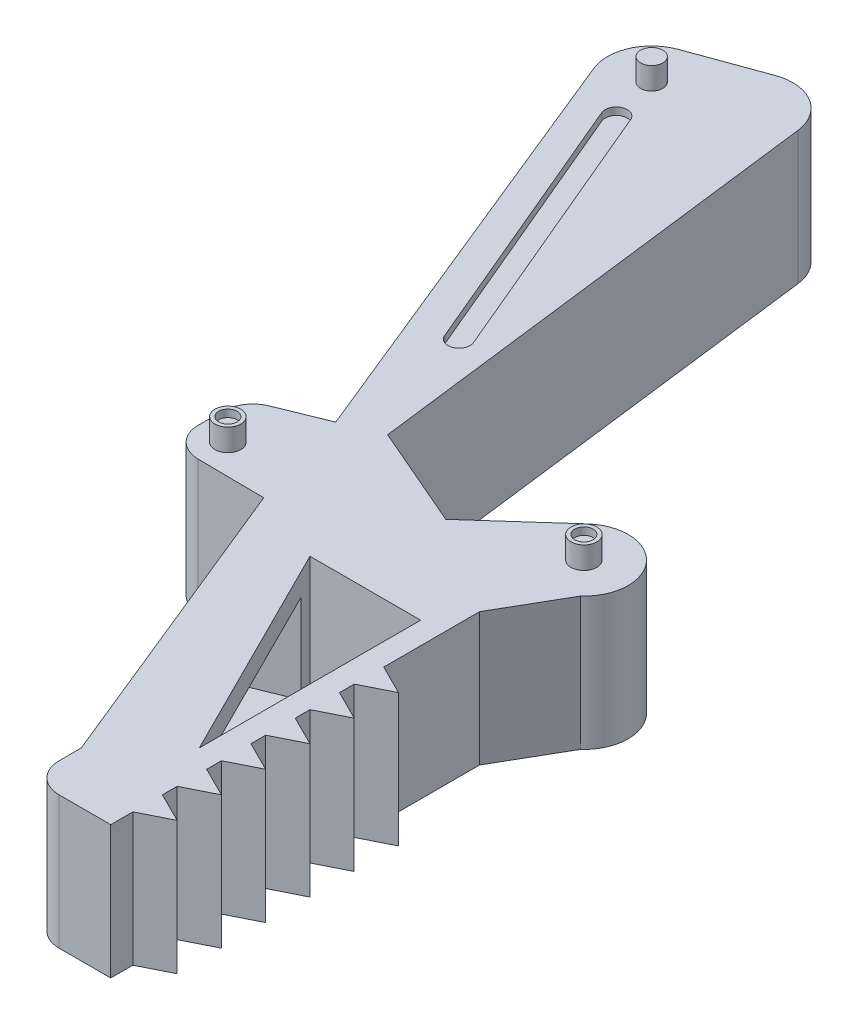
from build123d import *

# Parameters (mm, degrees)
BOSS_EXTRUDE1_DEPTH = 9
FILLET1_R           = 6
FILLET2_R           = 4
BOSS_EXTRUDE2_DEPTH = 18
LPATTERN1_COUNT     = 6
LPATTERN1_PITCH     = 6
CUT_EXTRUDE1_DEPTH  = 145.41368733
SKETCH6_W           = 30.064521177
SKETCH6_H           = 12
CUT_EXTRUDE2_DEPTH  = 10
SKETCH8_R           = 1.75
SKETCH8_R_2         = 1.5
BOSS_EXTRUDE3_DEPTH = 3
SKETCH9_R           = 1.25
CUT_EXTRUDE4_DEPTH  = 1
SKETCH10_R          = 1.25
CUT_EXTRUDE5_DEPTH  = 1
CUT_EXTRUDE6_DEPTH  = 1


with BuildPart() as part:
    # Sketch2 → Boss-Extrude1 (new, symmetric)
    with BuildSketch(Plane(origin=(0, 0, 0), x_dir=(1, 0, 0), z_dir=(0, 1, 0))):
        with BuildLine():
            ThreePointArc((7, -67.928205718), (15.472135955, -68.400341673), (15, -76.872477628))
            Line((15, -76.872477628), (10, -85.532731666))
            Line((10, -85.532731666), (10, -135.532731666))
            Line((10, -135.532731666), (-1, -135.532731666))
            Line((-1, -135.532731666), (-1, -128.532731666))
            Line((-1, -128.532731666), (-18, -86.797721556))
            Line((-18, -86.797721556), (-30.999248866, -86.657975615))
            Line((-30.999248866, -86.657975615), (-30.891751988, -76.658553411))
            Line((-30.891751988, -76.658553411), (-17, -71))
            Line((-17, -71), (-3.134175553, -76.992487891))
            Line((-3.134175553, -76.992487891), (7, -67.928205718))
        make_face()
        Polygon((-17, -71), (-22, -73.036659384), (-48.406582583, -8.20848344), (-25.853959684, 0), align=None)
    extrude(amount=BOSS_EXTRUDE1_DEPTH, both=True)

    # Fillet1
    fillet1_edges = [part.edges().sort_by_distance(p)[0] for p in [
        (-48.406582583, 0, 8.20848344),
        (-25.853959684, 0, 0),
    ]]
    fillet(fillet1_edges, radius=FILLET1_R)

    # Fillet2
    fillet2_edges = [part.edges().sort_by_distance(p)[0] for p in [
        (-1, 0, 135.532731666),
        (-30.999248866, 0, 86.657975615),
        (-30.891751988, 0, 76.658553411),
    ]]
    fillet(fillet2_edges, radius=FILLET2_R)

    # Sketch3 → Boss-Extrude2 (add)
    with BuildSketch(Plane(origin=(0, 9, 0), x_dir=(1, 0, 0), z_dir=(0, 1, 0))):
        Polygon((10, -132.532731666), (10, -128.532731666), (14, -130.532731666), align=None)
    boss_extrude2 = extrude(amount=-BOSS_EXTRUDE2_DEPTH)

    # LPattern1: Boss-Extrude2 ×6
    with Locations(*[(0, 0, -i * LPATTERN1_PITCH) for i in range(1, LPATTERN1_COUNT)]):
        add(boss_extrude2)

    # Sketch5 → Cut-Extrude1 (cut, through all)
    with BuildSketch(Plane(origin=(0, 9, 0), x_dir=(1, 0, 0), z_dir=(0, 1, 0))):
        Polygon((7, -120.532731666), (7, -90.532731666), (-8, -90.532731666), align=None)
    extrude(amount=-CUT_EXTRUDE1_DEPTH, mode=Mode.SUBTRACT)

    # Sketch6 → Cut-Extrude2 (cut)
    with BuildSketch(Plane(origin=(-45.762584731, 0, 18.64055953), x_dir=(0.377236894037746, 0, 0.9261167992088009), z_dir=(-0.9261167992088009, 0, 0.377236894037746))):
        with Locations((98.626824562, 0)):
            Rectangle(SKETCH6_W, SKETCH6_H)
    extrude(amount=-CUT_EXTRUDE2_DEPTH, mode=Mode.SUBTRACT)

    # Sketch8 → Boss-Extrude3 (add)
    with BuildSketch(Plane(origin=(0, 9, 0), x_dir=(1, 0, 0), z_dir=(0, 1, 0))):
        with Locations(Location((-26.956481233, -82.701205484, 0), (0, 0, 270))):
            Circle(SKETCH8_R)
        with Locations(Location((11, -72.400341673, 0), (0, 0, 270))):
            Circle(SKETCH8_R)
        with Locations(Location((-40.499373495, -11.715561331, 0), (0, 0, 270))):
            Circle(SKETCH8_R_2)
    boss_extrude3 = extrude(amount=BOSS_EXTRUDE3_DEPTH)

    # Sketch9 → Cut-Extrude4 (cut)
    with BuildSketch(Plane(origin=(0, 12, 0), x_dir=(1, 0, 0), z_dir=(0, 1, 0))):
        with Locations(Location((-26.956481233, -82.701205484, 0), (0, 0, 270))):
            Circle(SKETCH9_R)
    cut_extrude4 = extrude(amount=-CUT_EXTRUDE4_DEPTH, mode=Mode.SUBTRACT)

    # Sketch10 → Cut-Extrude5 (cut)
    with BuildSketch(Plane(origin=(0, 12, 0), x_dir=(1, 0, 0), z_dir=(0, 1, 0))):
        with Locations(Location((11, -72.400341673, 0), (0, 0, 270))):
            Circle(SKETCH10_R)
    cut_extrude5 = extrude(amount=-CUT_EXTRUDE5_DEPTH, mode=Mode.SUBTRACT)

    # Sketch11 → Cut-Extrude6 (cut)
    with BuildSketch(Plane(origin=(0, 9, 0), x_dir=(1, 0, 0), z_dir=(0, 1, 0))):
        with BuildLine():
            Line((-37.543355443, -17.510445966), (-22, -54.366980008))
            ThreePointArc((-22, -54.366980008), (-22.799244197, -56.331975863), (-24.764240053, -55.532731666))
            Line((-24.764240053, -55.532731666), (-40.307595496, -18.676197624))
            ThreePointArc((-40.307595496, -18.676197624), (-39.508351299, -16.711201768), (-37.543355443, -17.510445966))
        make_face()
    cut_extrude6 = extrude(amount=-CUT_EXTRUDE6_DEPTH, mode=Mode.SUBTRACT)

    # Mirror1: Boss-Extrude3, Cut-Extrude4, Cut-Extrude5, Cut-Extrude6 across plane
    add(boss_extrude3.mirror(Plane.ZX))
    add(cut_extrude4.mirror(Plane.ZX), mode=Mode.SUBTRACT)
    add(cut_extrude5.mirror(Plane.ZX), mode=Mode.SUBTRACT)
    add(cut_extrude6.mirror(Plane.ZX), mode=Mode.SUBTRACT)


solid = part.part
